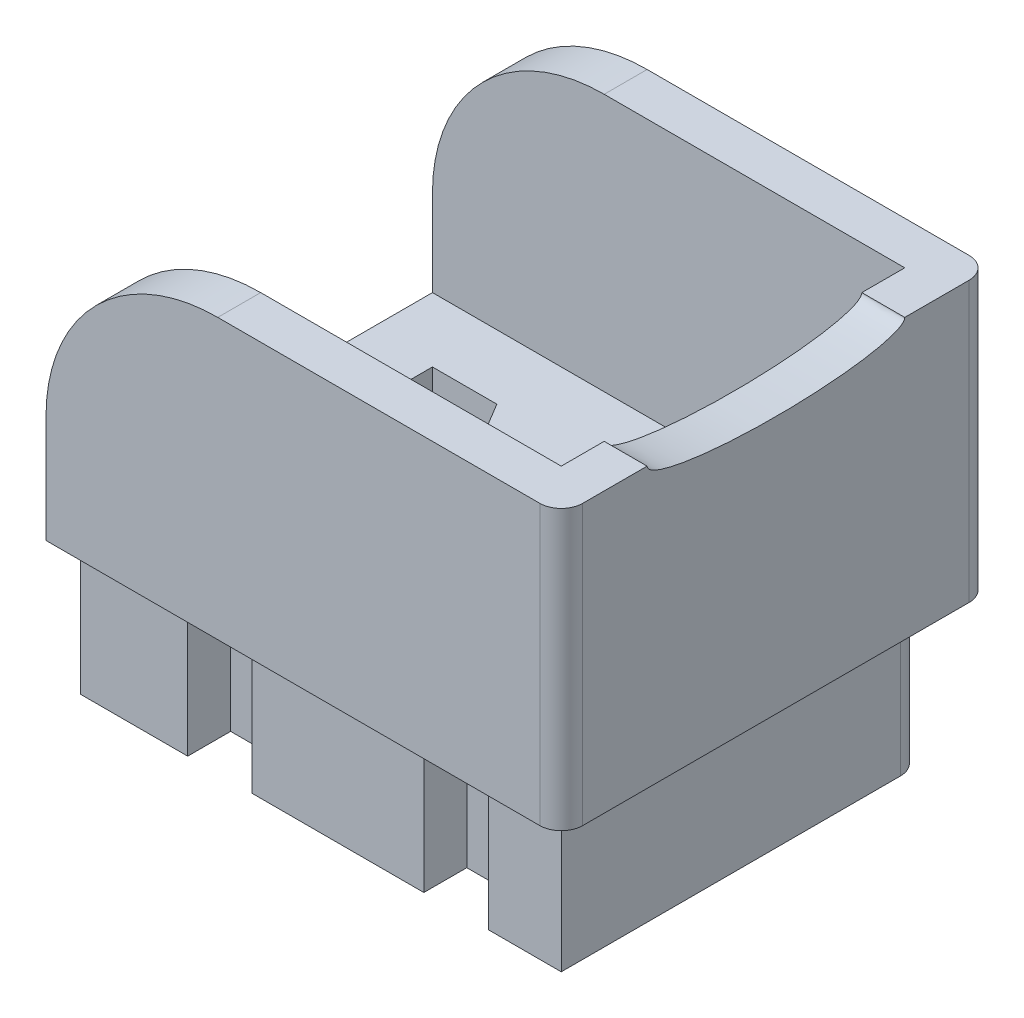
from build123d import *

# Parameters (mm, degrees)
BOSS_EXTRUDE2_DEPTH = 2
SKETCH8_R           = 0.46
CUT_EXTRUDE1_DEPTH  = 6.857687257
CUT_EXTRUDE3_DEPTH  = 5.308421985
BOSS_EXTRUDE3_DEPTH = 0.5
SKETCH11_W          = 5
SKETCH11_H          = 5
BOSS_EXTRUDE4_DEPTH = 0.5
FILLET1_R           = 2
CUT_EXTRUDE5_DEPTH  = 1.75
SKETCH13_W          = 0.75
SKETCH13_H          = 1.75
CUT_EXTRUDE4_DEPTH  = 0.5
FILLET2_R           = 0.25
FILLET3_R           = 0.25
SKETCH15_RX         = 1.5
SKETCH15_RY         = 0.25
CUT_EXTRUDE6_DEPTH  = 8.158910532


with BuildPart() as part:
    # Sketch5 → Boss-Extrude2 (new body)
    with BuildSketch(Plane(origin=(0, 0, 0), x_dir=(1, 0, 0), z_dir=(0, 1, 0))):
        Polygon((-2.25, -2), (1.75, -2), (3.25, -2), (3.25, 2), (1.75, 2), (-2.25, 2), align=None)
    extrude(amount=-BOSS_EXTRUDE2_DEPTH)

    # Sketch8 → Cut-Extrude1 (cut, through all)
    with BuildSketch(Plane(origin=(0.85, 2.55, 0), x_dir=(0.948683298050514, -0.3162277660168378, 0), z_dir=(0.3162277660168378, 0.948683298050514, 0))):
        with Locations((1.829822128, 0)):
            Circle(SKETCH8_R)
    extrude(amount=-CUT_EXTRUDE1_DEPTH, mode=Mode.SUBTRACT)

    # Sketch12 → Cut-Extrude3 (cut, through all)
    with BuildSketch(Plane(origin=(0, 0, 0), x_dir=(1, 0, 0), z_dir=(0, 1, 0))):
        Polygon((-1.5, 1.25), (-1.5, -1.25), (-0.75, -1.25), (0, 0), (-0.75, 1.25), align=None)
    extrude(amount=-CUT_EXTRUDE3_DEPTH, mode=Mode.SUBTRACT)

    # Sketch10 → Boss-Extrude3 (add)
    with BuildSketch(Plane.XY.offset(2)):
        Polygon((3.25, -2), (3.25, 3), (-2.25, 3), (-2.25, 0), (-2.25, -2), align=None)
    boss_extrude3 = extrude(amount=BOSS_EXTRUDE3_DEPTH)

    # Mirror1: Boss-Extrude3 across plane
    add(boss_extrude3.mirror(Plane.XY))

    # Sketch11 → Boss-Extrude4 (add)
    with BuildSketch(Plane(origin=(3.25, 0, 0), x_dir=(0, 0, -1), z_dir=(1, 0, 0))):
        with Locations((0, 0.5)):
            Rectangle(SKETCH11_W, SKETCH11_H)
    extrude(amount=BOSS_EXTRUDE4_DEPTH)

    # Fillet1
    fillet1_edges = [part.edges().sort_by_distance(p)[0] for p in [
        (-2.25, 3, 2.25),
        (-2.25, 3, -2.25),
    ]]
    fillet(fillet1_edges, radius=FILLET1_R)

    # Sketch14 → Cut-Extrude5 (cut)
    with BuildSketch(Plane.XZ.offset(2)):
        Polygon((-2.25, 2.5), (-2.25, 2.1), (3.35, 2.1), (3.35, -2.1), (-2.25, -2.1), (-2.25, -2.5), (3.75, -2.5), (3.75, 2.5), align=None)
    extrude(amount=-CUT_EXTRUDE5_DEPTH, mode=Mode.SUBTRACT)

    # Sketch13 → Cut-Extrude4 (cut)
    with BuildSketch(Plane.XY.offset(2.1)):
        with Locations((-0.625, -1.125)):
            Rectangle(SKETCH13_W, SKETCH13_H)
        with Locations((2.125, -1.125)):
            Rectangle(SKETCH13_W, SKETCH13_H)
    cut_extrude4 = extrude(amount=-CUT_EXTRUDE4_DEPTH, mode=Mode.SUBTRACT)

    # Mirror2: Cut-Extrude4 across plane
    add(cut_extrude4.mirror(Plane.XY), mode=Mode.SUBTRACT)

    # Fillet2
    fillet2_edges = [part.edges().sort_by_distance(p)[0] for p in [
        (2.925, -0.25, -2.1),
        (3.35, -0.25, 0),
        (3.35, -1.125, -2.1),
        (-1.625, -0.25, 2.1),
        (0.75, -0.25, 2.1),
        (2.925, -0.25, 2.1),
        (0.75, -0.25, -2.1),
        (-1.625, -0.25, -2.1),
    ]]
    fillet(fillet2_edges, radius=FILLET2_R)

    # Fillet3
    fillet3_edges = [part.edges().sort_by_distance(p)[0] for p in [
        (3.75, 1.375, -2.5),
        (3.75, 1.375, 2.5),
    ]]
    fillet(fillet3_edges, radius=FILLET3_R)

    # Sketch15 → Cut-Extrude6 (cut, through all)
    with BuildSketch(Plane(origin=(3.75, 0, 0), x_dir=(0, 0, -1), z_dir=(1, 0, 0))):
        with Locations((0, 3)):
            Ellipse(SKETCH15_RX, SKETCH15_RY)
    extrude(amount=-CUT_EXTRUDE6_DEPTH, mode=Mode.SUBTRACT)


solid = part.part
